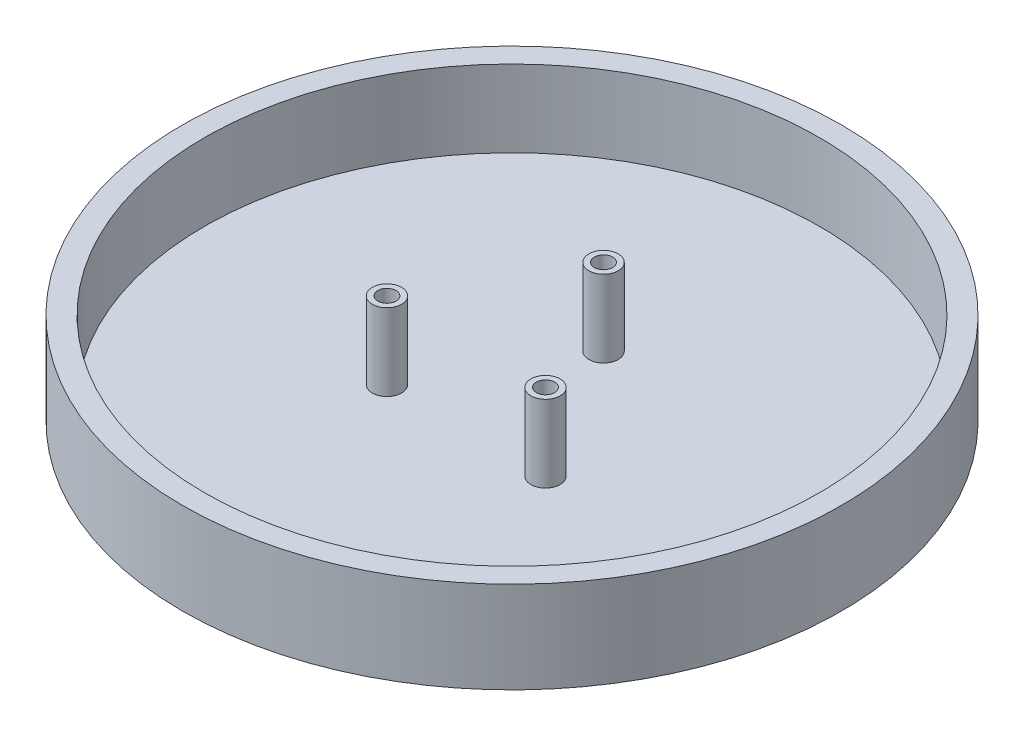
from build123d import *

# Parameters (mm, degrees)
SKETCH1_R             = 42
SKETCH1_R_2           = 2
BOSS_EXTRUDE1_DEPTH   = 2
SKETCH1_R_3           = 1.25
SKETCH1_R_4           = 0.8
BOSS_EXTRUDE1_2_DEPTH = 2
BOSS_EXTRUDE1_3_DEPTH = 2
BOSS_EXTRUDE1_4_DEPTH = 2
SKETCH1_3_R           = 45
SKETCH1_3_R_2         = 42
SKETCH1_3_R_3         = 2
SKETCH1_3_R_4         = 1.25
BOSS_EXTRUDE2_DEPTH   = 12.5


with BuildPart() as part:
    # Sketch1 → Boss-Extrude1 (new body)
    with BuildSketch(Plane(origin=(0, 0, 0), x_dir=(1, 0, 0), z_dir=(0, 1, 0))):
        Circle(SKETCH1_R)
        with Locations((-10.825317547, -6.25)):
            Circle(SKETCH1_R_2, mode=Mode.SUBTRACT)
        with Locations((10.825317547, -6.25)):
            Circle(SKETCH1_R_2, mode=Mode.SUBTRACT)
        with Locations((0, 12.5)):
            Circle(SKETCH1_R_2, mode=Mode.SUBTRACT)
    extrude(amount=BOSS_EXTRUDE1_DEPTH)

    # Sketch1<3> → Boss-Extrude2 (add)
    # profile 1 of 4: a face of its own
    with BuildSketch(Plane(origin=(0, 0, 0), x_dir=(1, 0, 0), z_dir=(0, 1, 0))):
        Circle(SKETCH1_3_R)
        Circle(SKETCH1_3_R_2, mode=Mode.SUBTRACT)
    # profile 2 of 4: a face of its own
    with BuildSketch(Plane(origin=(0, 0, 0), x_dir=(1, 0, 0), z_dir=(0, 1, 0))):
        with Locations((-10.825317547, -6.25)):
            Circle(SKETCH1_3_R_3)
        with Locations((-10.825317547, -6.25)):
            Circle(SKETCH1_3_R_4, mode=Mode.SUBTRACT)
    # profile 3 of 4: a face of its own
    with BuildSketch(Plane(origin=(0, 0, 0), x_dir=(1, 0, 0), z_dir=(0, 1, 0))):
        with Locations((10.825317547, -6.25)):
            Circle(SKETCH1_3_R_3)
        with Locations((10.825317547, -6.25)):
            Circle(SKETCH1_3_R_4, mode=Mode.SUBTRACT)
    # profile 4 of 4: a face of its own
    with BuildSketch(Plane(origin=(0, 0, 0), x_dir=(1, 0, 0), z_dir=(0, 1, 0))):
        with Locations((0, 12.5)):
            Circle(SKETCH1_3_R_3)
        with Locations((0, 12.5)):
            Circle(SKETCH1_3_R_4, mode=Mode.SUBTRACT)
    extrude(amount=BOSS_EXTRUDE2_DEPTH)


with BuildPart() as body_2:
    # Sketch1 → Boss-Extrude1 2 (new body)
    with BuildSketch(Plane(origin=(0, 0, 0), x_dir=(1, 0, 0), z_dir=(0, 1, 0))):
        with Locations((0, 12.5)):
            Circle(SKETCH1_R_3)
        with Locations((0, 12.5)):
            Circle(SKETCH1_R_4, mode=Mode.SUBTRACT)
    extrude(amount=BOSS_EXTRUDE1_2_DEPTH)


with BuildPart() as body_3:
    # Sketch1 → Boss-Extrude1 3 (new body)
    with BuildSketch(Plane(origin=(0, 0, 0), x_dir=(1, 0, 0), z_dir=(0, 1, 0))):
        with Locations((10.825317547, -6.25)):
            Circle(SKETCH1_R_3)
        with Locations((10.825317547, -6.25)):
            Circle(SKETCH1_R_4, mode=Mode.SUBTRACT)
    extrude(amount=BOSS_EXTRUDE1_3_DEPTH)


with BuildPart() as body_4:
    # Sketch1 → Boss-Extrude1 4 (new body)
    with BuildSketch(Plane(origin=(0, 0, 0), x_dir=(1, 0, 0), z_dir=(0, 1, 0))):
        with Locations((-10.825317547, -6.25)):
            Circle(SKETCH1_R_3)
        with Locations((-10.825317547, -6.25)):
            Circle(SKETCH1_R_4, mode=Mode.SUBTRACT)
    extrude(amount=BOSS_EXTRUDE1_4_DEPTH)


solid = Compound([part.part, body_2.part, body_3.part, body_4.part])
